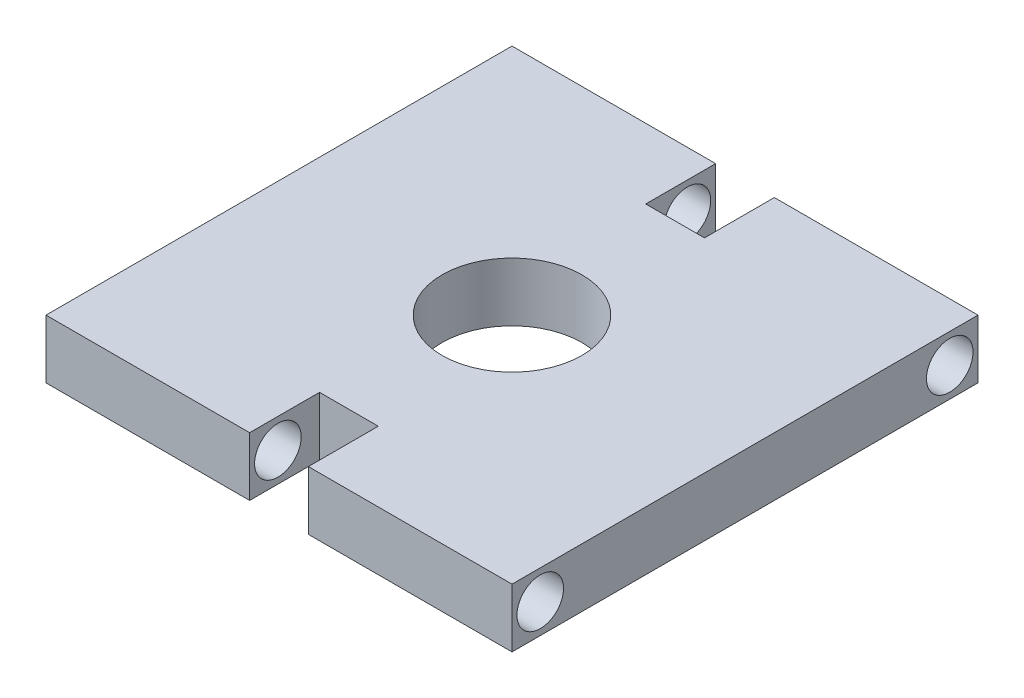
from build123d import *

# Parameters (mm, degrees)
SKETCH1_R           = 3.81
BOSS_EXTRUDE1_DEPTH = 3.2004
SKETCH3_R           = 1.27
CUT_EXTRUDE2_DEPTH  = 37.063313217


with BuildPart() as part:
    # Sketch1 → Boss-Extrude1 (new body)
    with BuildSketch(Plane(origin=(0, 0, 0), x_dir=(1, 0, 0), z_dir=(0, 1, 0))):
        Polygon((0, 25.4), (11.0998, 25.4), (11.0998, 21.59), (14.3002, 21.59), (14.3002, 25.4), (25.4, 25.4), (25.4, 0), (14.3002, 0), (14.3002, 3.81), (11.0998, 3.81), (11.0998, 0), (0, 0), align=None)
        with Locations(Location((12.7, 12.7, 0), (0, 0, 270))):
            Circle(SKETCH1_R, mode=Mode.SUBTRACT)
    extrude(amount=BOSS_EXTRUDE1_DEPTH)

    # Sketch3 → Cut-Extrude2 (cut, through all)
    with BuildSketch(Plane(origin=(25.4, 0, 0), x_dir=(0, 0, -1), z_dir=(1, 0, 0))):
        with Locations((23.860164918, 1.6002)):
            Circle(SKETCH3_R)
        with Locations((1.539835082, 1.6002)):
            Circle(SKETCH3_R)
    extrude(amount=-CUT_EXTRUDE2_DEPTH, mode=Mode.SUBTRACT)


solid = part.part
